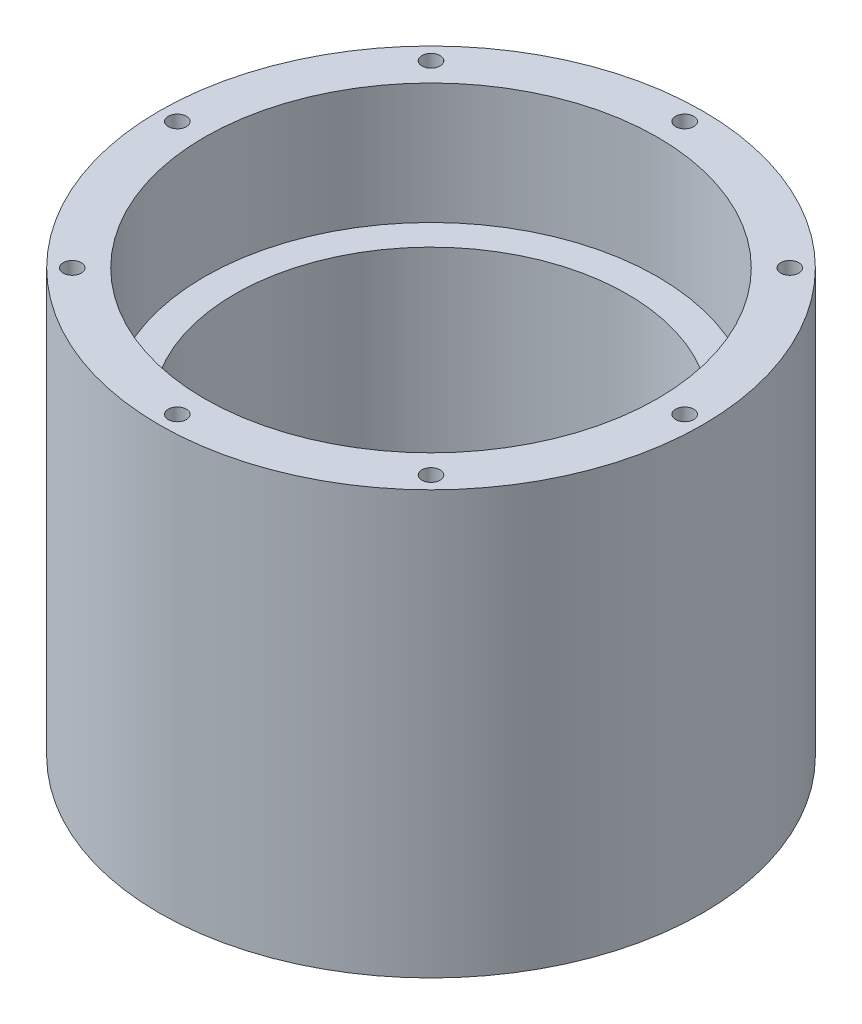
from build123d import *

# Parameters (mm, degrees)
SKETCH1_R           = 45
SKETCH1_R_2         = 37.5
BOSS_EXTRUDE1_DEPTH = 35
SKETCH2_R           = 42.5
SKETCH2_R_2         = 32.5
EXTRUDE_THIN1_DEPTH = 15
SKETCH3_R           = 1.5
CUT_EXTRUDE1_DEPTH  = 95.604439642
CIRPATTERN1_COUNT   = 8


with BuildPart() as part:
    # Sketch1 → Boss-Extrude1 (new, symmetric)
    with BuildSketch(Plane(origin=(0, 0, 0), x_dir=(1, 0, 0), z_dir=(0, 1, 0))):
        with Locations(Location((0, 0, 0), (0, 0, 270))):
            Circle(SKETCH1_R)
        with Locations(Location((0, 0, 0), (0, 0, 270))):
            Circle(SKETCH1_R_2, mode=Mode.SUBTRACT)
    extrude(amount=BOSS_EXTRUDE1_DEPTH, both=True)

    # Sketch2 → Extrude-Thin1 (add, symmetric)
    with BuildSketch(Plane(origin=(0, 0, 0), x_dir=(1, 0, 0), z_dir=(0, 1, 0))):
        Circle(SKETCH2_R)
        Circle(SKETCH2_R_2, mode=Mode.SUBTRACT)
    extrude(amount=EXTRUDE_THIN1_DEPTH, both=True)

    # Sketch3 → Cut-Extrude1 (cut, through all)
    with BuildSketch(Plane(origin=(0, 35, 0), x_dir=(1, 0, 0), z_dir=(0, 1, 0))):
        with Locations(Location((0, 42, 0), (0, 0, 270))):
            Circle(SKETCH3_R)
    cut_extrude1 = extrude(amount=-CUT_EXTRUDE1_DEPTH, mode=Mode.SUBTRACT)

    # CirPattern1: Cut-Extrude1 ×8 about axis
    cirpattern1_axis = Axis((0, 0, 0), (0, 1, 0))
    for i in range(1, CIRPATTERN1_COUNT):
        add(cut_extrude1.rotate(cirpattern1_axis, i * 360 / CIRPATTERN1_COUNT), mode=Mode.SUBTRACT)


solid = part.part
